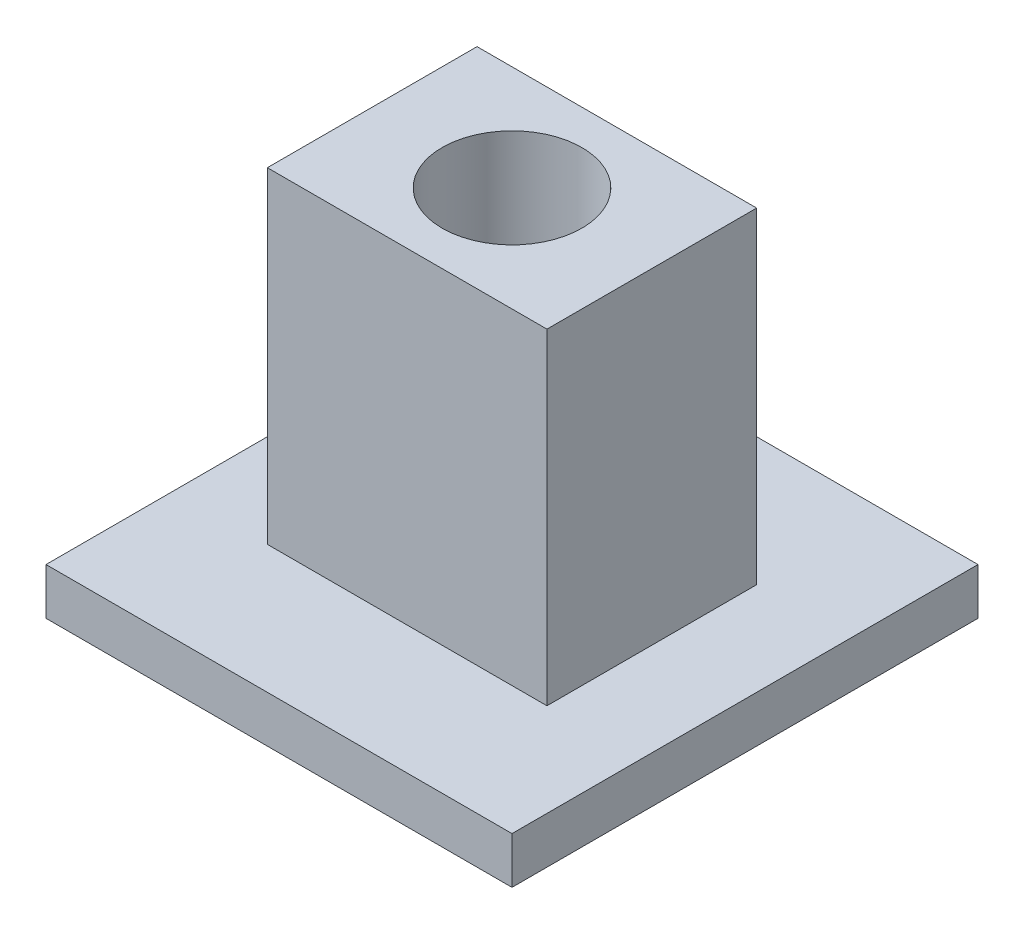
from build123d import *

# Parameters (mm, degrees)
SKETCH_1_W      = 20
SKETCH_1_H      = 20
EXTRUDE_1_DEPTH = 2
SKETCH_2_W      = 12
SKETCH_2_H      = 9
SKETCH_2_R      = 3
EXTRUDE_2_DEPTH = 14


with BuildPart() as part:
    # 草图1 → 凸台-拉伸1 (new body)
    with BuildSketch(Plane(origin=(0, 0, 0), x_dir=(1, 0, 0), z_dir=(0, 1, 0))):
        Rectangle(SKETCH_1_W, SKETCH_1_H)
    extrude(amount=EXTRUDE_1_DEPTH)

    # 草图2 → 凸台-拉伸2 (add)
    with BuildSketch(Plane(origin=(0, 2, 0), x_dir=(1, 0, 0), z_dir=(0, 1, 0))):
        Rectangle(SKETCH_2_W, SKETCH_2_H)
        with Locations(Location((0, 0, 0), (0, 0, 270))):
            Circle(SKETCH_2_R, mode=Mode.SUBTRACT)
    extrude(amount=EXTRUDE_2_DEPTH)


solid = part.part
